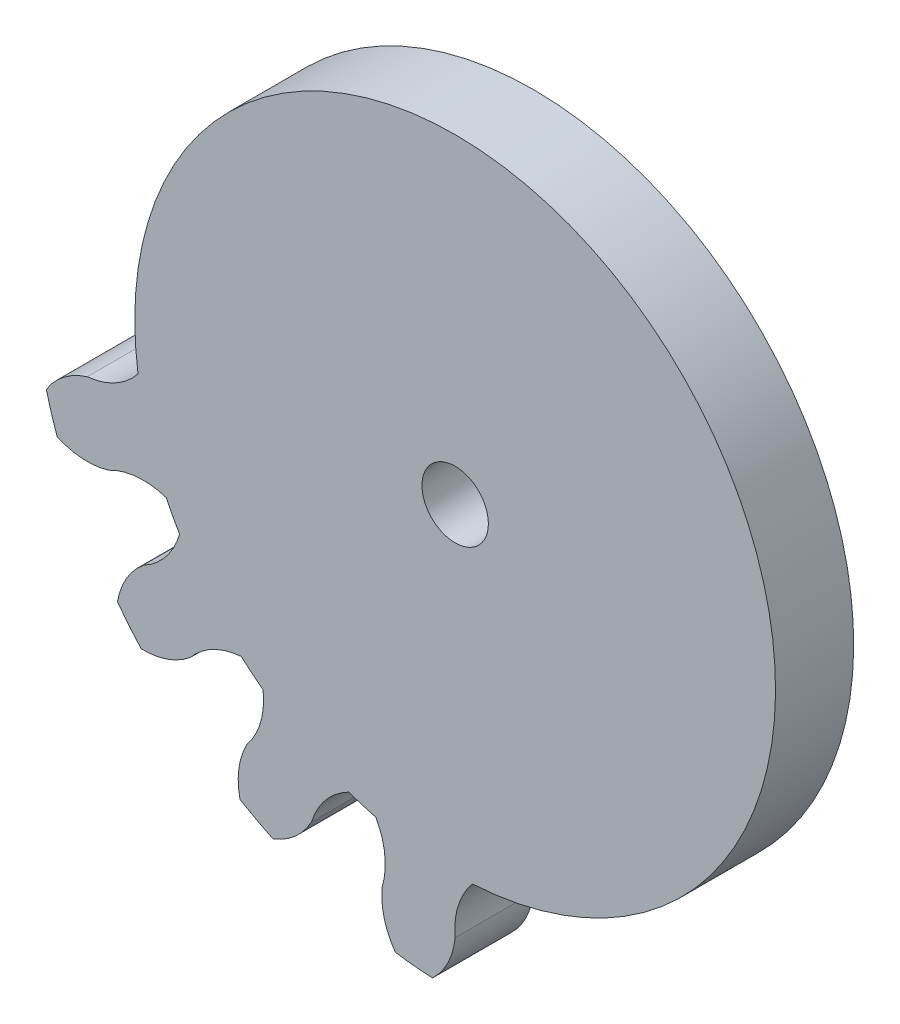
from build123d import *

# Parameters (mm, degrees)
SKETCH1_R           = 54
BOSS_EXTRUDE1_DEPTH = 10
CUT_EXTRUDE1_START  = -10
CUT_EXTRUDE1_DEPTH  = 10
CIRPATTERN1_COUNT   = 16
CUT_EXTRUDE2_START  = -10
CUT_EXTRUDE2_DEPTH  = 10
SKETCH5_R           = 4.25
CUT_EXTRUDE3_DEPTH  = 10


with BuildPart() as part:
    # Sketch1 → Boss-Extrude1 (new body)
    with BuildSketch(Plane.XY):
        Circle(SKETCH1_R)
    extrude(amount=BOSS_EXTRUDE1_DEPTH)

    # Sketch2 → Cut-Extrude1 (cut)
    with BuildSketch(Plane.XY.offset(10).offset(CUT_EXTRUDE1_START)):
        with BuildLine():
            ThreePointArc((-2.226451575, 40.937500136), (-0.390558879, 44.240929479), (0, 48))
            ThreePointArc((0, 48), (0.916562017, 51.223157404), (2.90289612, 53.921917567))
            ThreePointArc((2.90289612, 53.921917567), (-5.3015625, 53.739123877), (-13.383578744, 52.315196836))
            ThreePointArc((-13.383578744, 52.315196836), (-10.908183383, 50.056602718), (-9.379467454, 47.07468099))
            ThreePointArc((-9.379467454, 47.07468099), (-8.261894241, 43.464393254), (-5.815884428, 40.583389365))
            ThreePointArc((-5.815884428, 40.583389365), (-4.025064063, 40.79993705), (-2.226451575, 40.937500136))
        make_face()
    cut_extrude1 = extrude(amount=CUT_EXTRUDE1_DEPTH, mode=Mode.SUBTRACT)

    # CirPattern1: Cut-Extrude1 ×16 about axis
    cirpattern1_axis = Axis((0, 0, 0), (0, 0, 1))
    for i in range(1, CIRPATTERN1_COUNT):
        add(cut_extrude1.rotate(cirpattern1_axis, i * 360 / CIRPATTERN1_COUNT), mode=Mode.SUBTRACT)

    # Sketch4 → Cut-Extrude2 (cut)
    with BuildSketch(Plane.XY.offset(10).offset(CUT_EXTRUDE2_START)):
        with BuildLine():
            ThreePointArc((-31.696062253, 26.003762067), (-19.456690994, 36.087022315), (-4.306352435, 40.771207153))
            Line((-4.306352435, 40.771207153), (-5.672057942, 53.701282654))
            ThreePointArc((-5.672057942, 53.701282654), (-41.865929649, 34.106362085), (-53.739123877, -5.3015625))
            Line((-53.739123877, -5.3015625), (-40.79993705, -4.025064063))
            ThreePointArc((-40.79993705, -4.025064063), (-39.234552099, 11.894785646), (-31.696062253, 26.003762067))
        make_face()
        with BuildLine():
            ThreePointArc((-4.306352435, 40.771207153), (40.771207153, 4.306352435), (4.306352435, -40.771207153))
            Line((4.306352435, -40.771207153), (5.672057942, -53.701282654))
            ThreePointArc((5.672057942, -53.701282654), (53.701282654, 5.672057942), (-5.672057942, 53.701282654))
            Line((-5.672057942, 53.701282654), (-4.306352435, 40.771207153))
        make_face()
    extrude(amount=CUT_EXTRUDE2_DEPTH, mode=Mode.SUBTRACT)

    # Sketch5 → Cut-Extrude3 (cut)
    with BuildSketch(Plane.XY.offset(10)):
        Circle(SKETCH5_R)
    extrude(amount=-CUT_EXTRUDE3_DEPTH, mode=Mode.SUBTRACT)


solid = part.part
